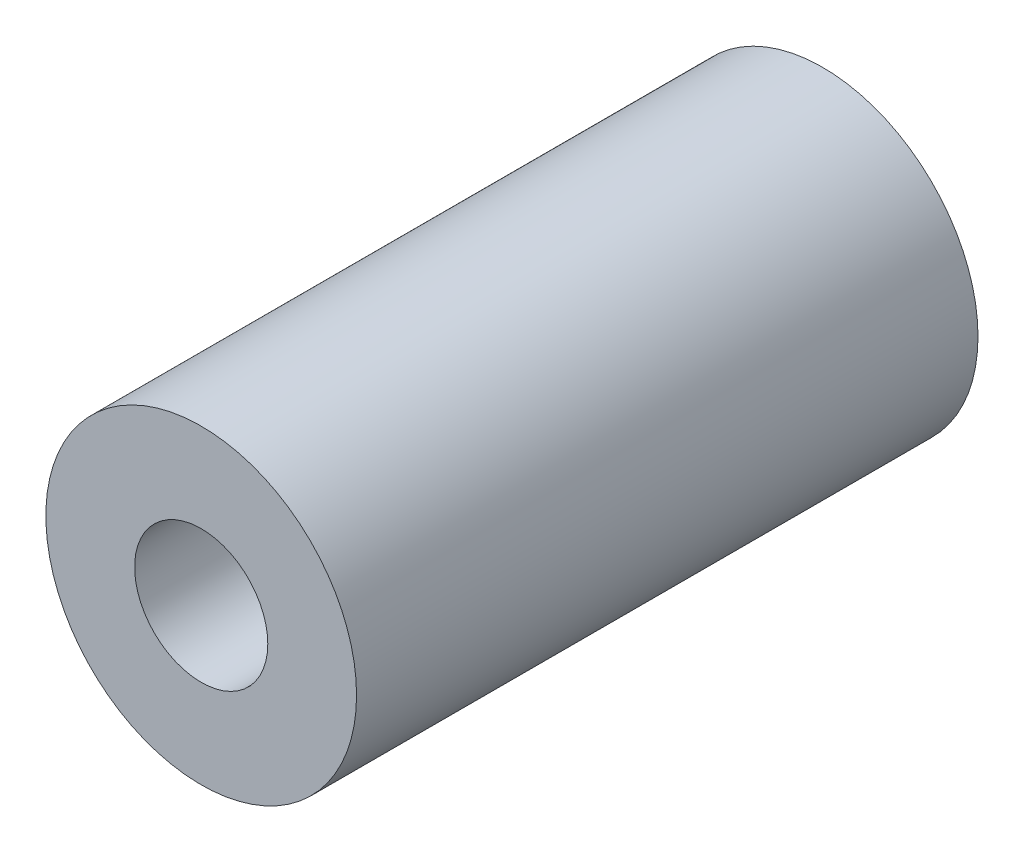
from build123d import *

# Parameters (mm, degrees)
SKETCH1_R           = 3.4999981
SKETCH1_R_2         = 1.4999981
EXTRUDE_THIN1_DEPTH = 14


with BuildPart() as part:
    # Sketch1 → Extrude-Thin1 (new body)
    with BuildSketch(Plane.XY):
        with Locations((79.999991481, 72.631397067)):
            Circle(SKETCH1_R)
        with Locations((79.999991481, 72.631397067)):
            Circle(SKETCH1_R_2, mode=Mode.SUBTRACT)
    extrude(amount=EXTRUDE_THIN1_DEPTH)


solid = part.part
